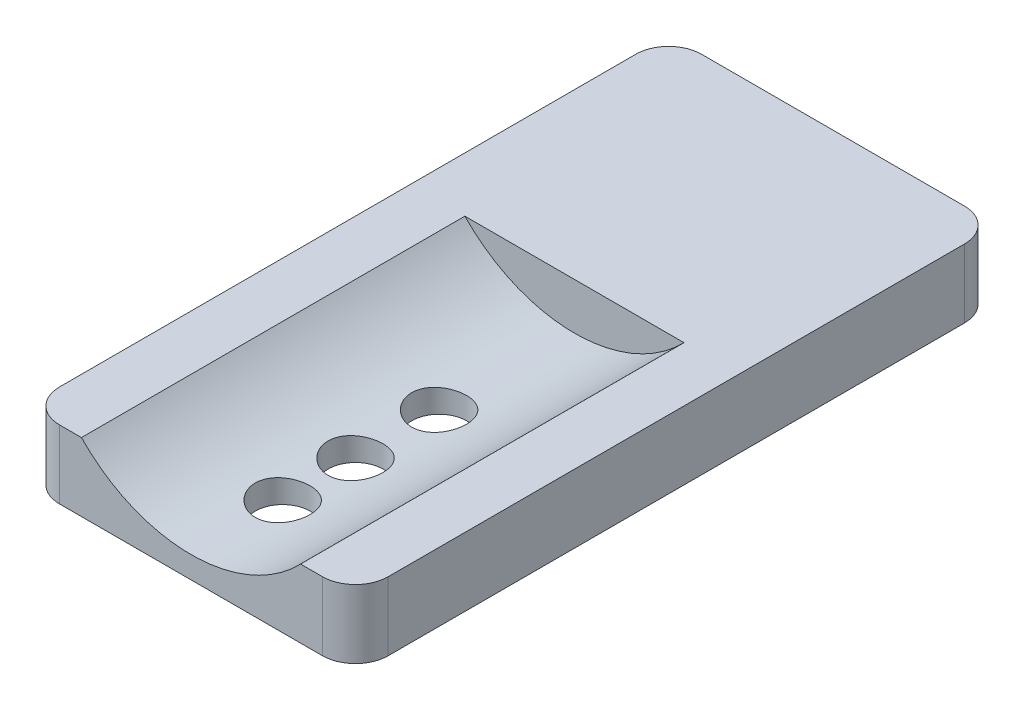
from build123d import *

# Parameters (mm, degrees)
SKETCH1_W               = 58.6
SKETCH1_H               = 6.25
BOSS_EXTRUDE1_DEPTH     = 30
CUT_EXTRUDE1_DEPTH      = 67.128832592
CUT_EXTRUDE1_DEPTH_BACK = 35
SKETCH4_R               = 2.5
SKETCH4_W               = 15.6
SKETCH4_H               = 10.5
CUT_EXTRUDE2_DEPTH      = 4
CUT_EXTRUDE3_DEPTH      = 9.5
SKETCH6_W               = 15.6
SKETCH6_H               = 1
SKETCH6_H_2             = 0.5
CUT_EXTRUDE4_DEPTH      = 4
FILLET1_R               = 3
SKETCH7_R               = 1.65
CUT_EXTRUDE5_DEPTH      = 3


with BuildPart() as part:
    # Sketch1 → Boss-Extrude1 (new body)
    with BuildSketch(Plane(origin=(0, 0, 0), x_dir=(0, 0, -1), z_dir=(1, 0, 0))):
        with Locations((29.3, 3.125)):
            Rectangle(SKETCH1_W, SKETCH1_H)
    extrude(amount=BOSS_EXTRUDE1_DEPTH)

    # Sketch2 → Cut-Extrude1 (cut, two sides: drawn at the far end of the back side and taken through both)
    with BuildSketch(Plane.XY.offset(-CUT_EXTRUDE1_DEPTH_BACK)):
        with BuildLine():
            Line((5, 6.25), (25, 6.25))
            ThreePointArc((25, 6.25), (15, 2), (5, 6.25))
        make_face()
    extrude(amount=CUT_EXTRUDE1_DEPTH + CUT_EXTRUDE1_DEPTH_BACK, mode=Mode.SUBTRACT)

    # Sketch4 → Cut-Extrude2 (cut)
    with BuildSketch(Plane.XZ):
        with Locations(Location((15, -8.37, 0), (0, 0, 270))):
            Circle(SKETCH4_R)
        with Locations(Location((15, -15.02, 0), (0, 0, 270))):
            Circle(SKETCH4_R)
        with Locations(Location((15, -22.65, 0), (0, 0, 270))):
            Circle(SKETCH4_R)
        with Locations((15, -43.35)):
            Rectangle(SKETCH4_W, SKETCH4_H)
    extrude(amount=-CUT_EXTRUDE2_DEPTH, mode=Mode.SUBTRACT)

    # Sketch5 → Cut-Extrude3 (cut)
    with BuildSketch(Plane(origin=(0, 0, -58.6), x_dir=(-1, 0, 0), z_dir=(0, 0, -1))):
        Polygon((-9.85, 1), (-20.15, 1), (-18.025, 3.125), (-20.15, 5.25), (-9.85, 5.25), align=None)
    extrude(amount=-CUT_EXTRUDE3_DEPTH, mode=Mode.SUBTRACT)

    # Sketch6 → Cut-Extrude4 (cut)
    with BuildSketch(Plane.XZ):
        with Locations((15, -37.6)):
            Rectangle(SKETCH6_W, SKETCH6_H)
        with Locations((15, -48.85)):
            Rectangle(SKETCH6_W, SKETCH6_H_2)
    extrude(amount=-CUT_EXTRUDE4_DEPTH, mode=Mode.SUBTRACT)

    # Fillet1
    fillet1_edges = [part.edges().sort_by_distance(p)[0] for p in [
        (30, 3.125, -58.6),
        (30, 3.125, 0),
        (0, 3.125, -58.6),
        (0, 3.125, 0),
    ]]
    fillet(fillet1_edges, radius=FILLET1_R)

    # Sketch7 → Cut-Extrude5 (cut)
    with BuildSketch(Plane.XZ):
        with Locations(Location((3, -55.6, 0), (0, 0, 270))):
            Circle(SKETCH7_R)
        with Locations(Location((27, -55.6, 0), (0, 0, 90))):
            Circle(SKETCH7_R)
        with Locations(Location((27, -3, 0), (0, 0, 270))):
            Circle(SKETCH7_R)
        with Locations(Location((3, -3, 0), (0, 0, 90))):
            Circle(SKETCH7_R)
    extrude(amount=-CUT_EXTRUDE5_DEPTH, mode=Mode.SUBTRACT)


solid = part.part
